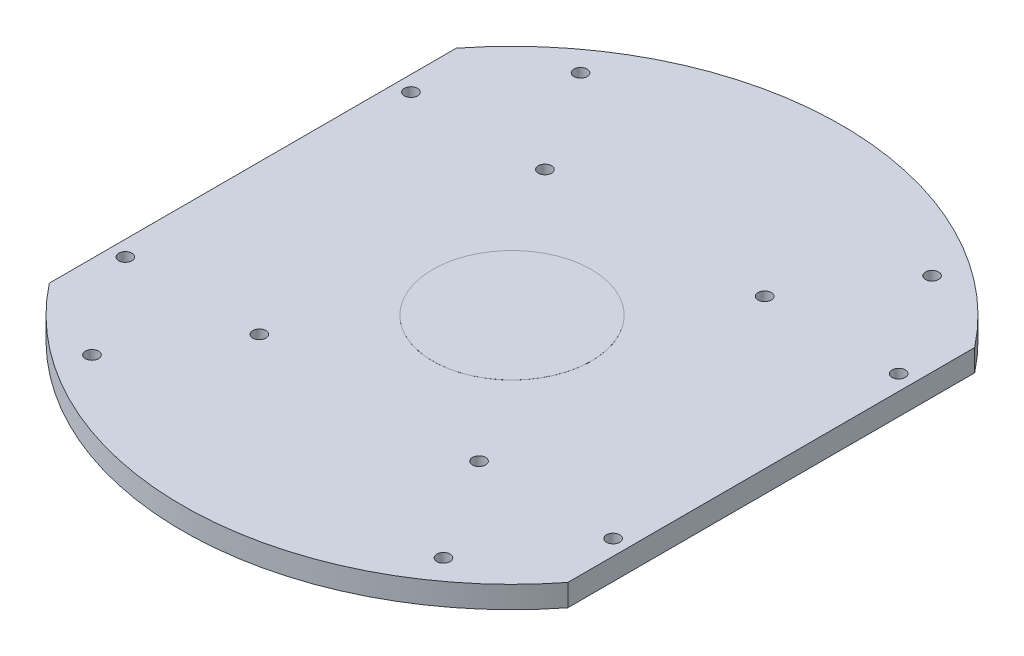
from build123d import *

# Parameters (mm, degrees)
SKETCH1_R               = 75
TRAY_DEPTH              = 5
SKETCH2_R               = 1.5
SUPPORT_HOLES_DEPTH     = 5
SKETCH4_R               = 1.5
MOTORDRIVER_HOLES_DEPTH = 5
CUT_EXTRUDE1_START      = -10
CUT_EXTRUDE1_DEPTH      = 10
SKETCH7_R               = 18.055784347
BOSS_EXTRUDE1_DEPTH     = 0.01


with BuildPart() as part:
    # Sketch1 → Tray (new body)
    with BuildSketch(Plane(origin=(0, 0, 0), x_dir=(1, 0, 0), z_dir=(0, 1, 0))):
        with Locations(Location((0, 0, 0), (0, 0, 270))):
            Circle(SKETCH1_R)
    extrude(amount=TRAY_DEPTH)

    # Sketch2 → Support Holes (cut)
    with BuildSketch(Plane(origin=(0, 5, 0), x_dir=(1, 0, 0), z_dir=(0, 1, 0))):
        with Locations(Location((-40, 55.6, 0), (0, 0, 270))):
            Circle(SKETCH2_R)
        with Locations(Location((40, 55.6, 0), (0, 0, 90))):
            Circle(SKETCH2_R)
        with Locations(Location((40, -55.6, 0), (0, 0, 270))):
            Circle(SKETCH2_R)
        with Locations(Location((-40, -55.6, 0), (0, 0, 90))):
            Circle(SKETCH2_R)
    extrude(amount=-SUPPORT_HOLES_DEPTH, mode=Mode.SUBTRACT)

    # Sketch4 → MotorDriver Holes (cut)
    with BuildSketch(Plane(origin=(0, 5, 0), x_dir=(1, 0, 0), z_dir=(0, 1, 0))):
        with Locations(Location((-55.5, 32.5, 0), (0, 0, 270))):
            Circle(SKETCH4_R)
        with Locations(Location((-25, 32.5, 0), (0, 0, 270))):
            Circle(SKETCH4_R)
        with Locations(Location((-55.5, -32.5, 0), (0, 0, 270))):
            Circle(SKETCH4_R)
        with Locations(Location((-25, -32.5, 0), (0, 0, 270))):
            Circle(SKETCH4_R)
        with Locations(Location((55.5, -32.5, 0), (0, 0, 90))):
            Circle(SKETCH4_R)
        with Locations(Location((25, -32.5, 0), (0, 0, 90))):
            Circle(SKETCH4_R)
        with Locations(Location((25, 32.5, 0), (0, 0, 90))):
            Circle(SKETCH4_R)
        with Locations(Location((55.5, 32.5, 0), (0, 0, 90))):
            Circle(SKETCH4_R)
    extrude(amount=-MOTORDRIVER_HOLES_DEPTH, mode=Mode.SUBTRACT)

    # Sketch6 → Cut-Extrude1 (cut)
    with BuildSketch(Plane(origin=(0, 5, 0), x_dir=(1, 0, 0), z_dir=(0, 1, 0)).offset(CUT_EXTRUDE1_START)):
        with BuildLine():
            Line((-59, 46.303347611), (-59, -46.303347611))
            ThreePointArc((-59, -46.303347611), (-75, 0), (-59, 46.303347611))
        make_face()
        with BuildLine():
            Line((59, 46.303347611), (59, -46.303347611))
            ThreePointArc((59, -46.303347611), (75, 0), (59, 46.303347611))
        make_face()
    extrude(amount=CUT_EXTRUDE1_DEPTH, mode=Mode.SUBTRACT)


with BuildPart() as body_2:
    # Sketch7 → Boss-Extrude1 (new body)
    with BuildSketch(Plane(origin=(0, 5, 0), x_dir=(1, 0, 0), z_dir=(0, 1, 0))):
        with Locations(Location((0, 0, 0), (0, 0, 90))):
            Circle(SKETCH7_R)
    extrude(amount=BOSS_EXTRUDE1_DEPTH)


solid = Compound([part.part, body_2.part])
